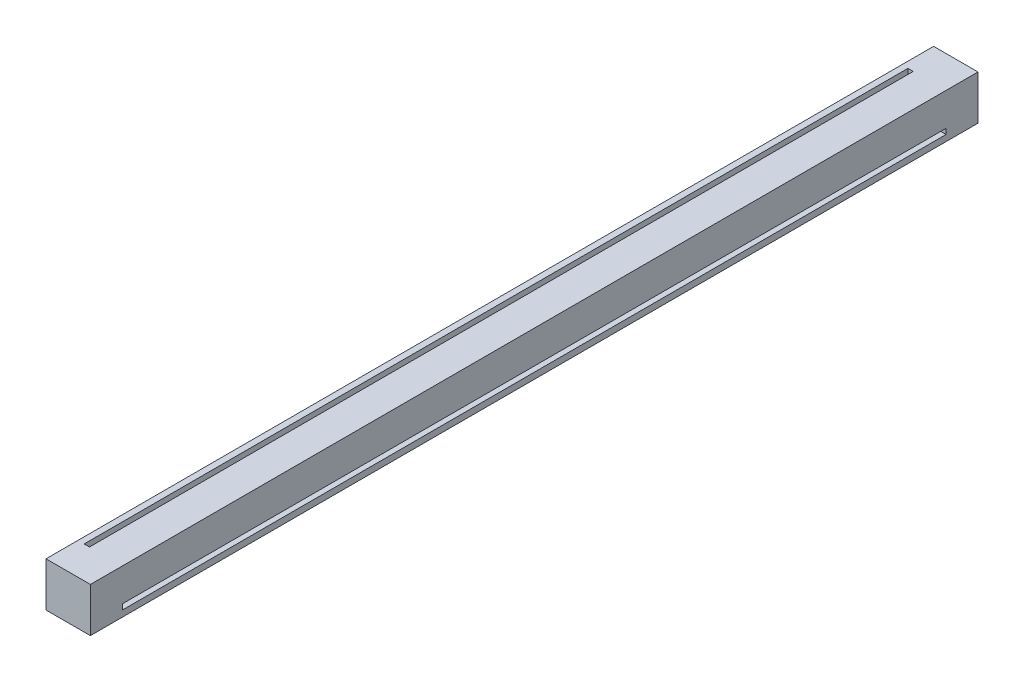
from build123d import *

# Parameters (mm, degrees)
SZKIC1_W                       = 25
SZKIC1_H                       = 25
DODANIE_WYCI_GNI_CIE1_DEPTH    = 500
SZKIC2_W                       = 3
SZKIC2_H                       = 464
WYTNIJ_WYCI_GNI_CIE1_DEPTH     = 3
SZKIC3_W                       = 464
SZKIC3_H                       = 3
WYTNIJ_WYCI_GNI_CIE2_DEPTH     = 3
OTWORY_USTALAJ_CE_3_0MM1_D     = 3
OTWORY_USTALAJ_CE_3_0MM1_DEPTH = 16
OTWORY_USTALAJ_CE_3_0MM1_TIP   = 0.901290929


with BuildPart() as part:
    # Szkic1 → Dodanie-wyciągnięcie1 (new body)
    with BuildSketch(Plane.XY):
        with Locations((12.5, 12.5)):
            Rectangle(SZKIC1_W, SZKIC1_H)
    extrude(amount=DODANIE_WYCI_GNI_CIE1_DEPTH)

    # Szkic2 → Wytnij-wyciągnięcie1 (cut)
    with BuildSketch(Plane(origin=(0, 25, 0), x_dir=(1, 0, 0), z_dir=(0, 1, 0))):
        with Locations((5, -250)):
            Rectangle(SZKIC2_W, SZKIC2_H)
    extrude(amount=-WYTNIJ_WYCI_GNI_CIE1_DEPTH, mode=Mode.SUBTRACT)

    # Szkic3 → Wytnij-wyciągnięcie2 (cut)
    with BuildSketch(Plane(origin=(25, 0, 0), x_dir=(0, 0, -1), z_dir=(1, 0, 0))):
        with Locations((-250, 5)):
            Rectangle(SZKIC3_W, SZKIC3_H)
    extrude(amount=-WYTNIJ_WYCI_GNI_CIE2_DEPTH, mode=Mode.SUBTRACT)

    # Otwory ustalające Ø3.0mm1
    with Locations(Plane(origin=(0, 0, 0), x_dir=(-1, 0, 0), z_dir=(0, 0, -1))):
        with Locations((-14, 10)):
            Hole(OTWORY_USTALAJ_CE_3_0MM1_D / 2, depth=OTWORY_USTALAJ_CE_3_0MM1_DEPTH)
            with Locations((0, 0, -(OTWORY_USTALAJ_CE_3_0MM1_DEPTH + OTWORY_USTALAJ_CE_3_0MM1_TIP / 2))):  # 118° drill point
                Cone(0, OTWORY_USTALAJ_CE_3_0MM1_D / 2, OTWORY_USTALAJ_CE_3_0MM1_TIP, mode=Mode.SUBTRACT)


solid = part.part
